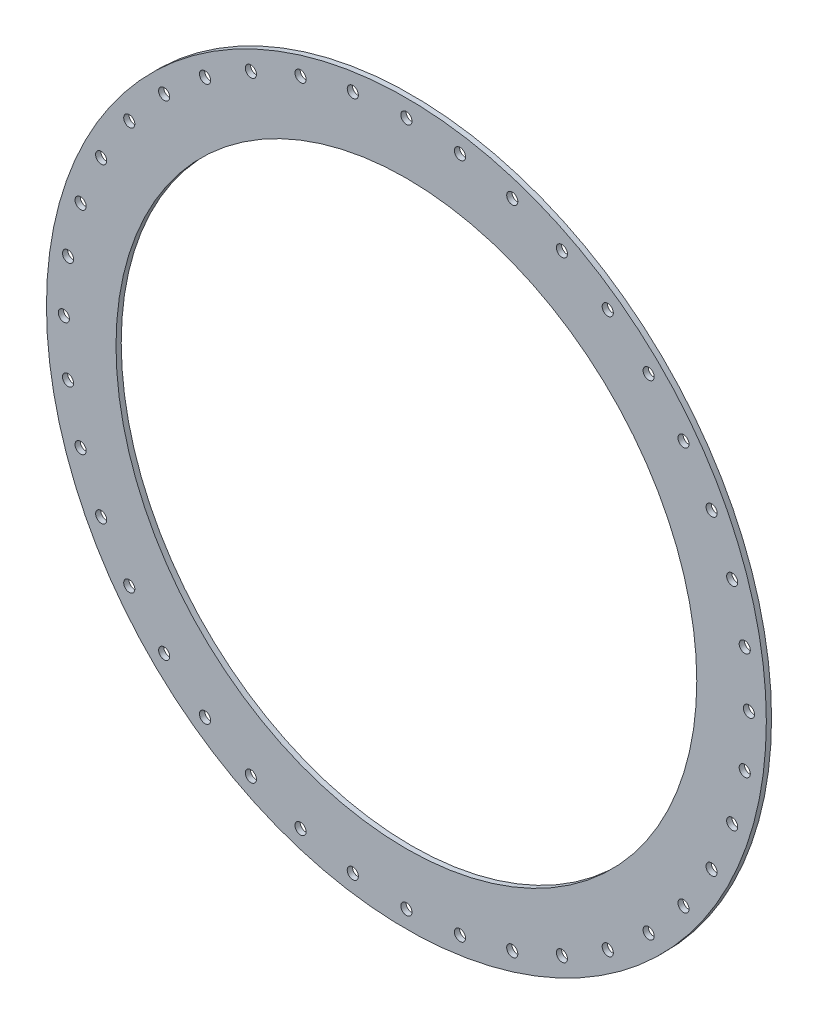
from build123d import *

# Parameters (mm, degrees)
SKETCH_1_R      = 103.5
SKETCH_1_R_2    = 83.5
SKETCH_1_R_3    = 1.6
EXTRUDE_1_DEPTH = 1.5


with BuildPart() as part:
    # 草图1 → 凸台-拉伸1 (new body)
    with BuildSketch(Plane.XY):
        Circle(SKETCH_1_R)
        Circle(SKETCH_1_R_2, mode=Mode.SUBTRACT)
        with Locations((0, 98.5)):
            Circle(SKETCH_1_R_3, mode=Mode.SUBTRACT)
        with Locations((15.408794806, 97.287301549)):
            Circle(SKETCH_1_R_3, mode=Mode.SUBTRACT)
        with Locations((30.438173946, 93.679066855)):
            Circle(SKETCH_1_R_3, mode=Mode.SUBTRACT)
        with Locations((44.718064224, 87.764142633)):
            Circle(SKETCH_1_R_3, mode=Mode.SUBTRACT)
        with Locations((57.896847351, 79.688173946)):
            Circle(SKETCH_1_R_3, mode=Mode.SUBTRACT)
        with Locations((69.650017947, 69.650017947)):
            Circle(SKETCH_1_R_3, mode=Mode.SUBTRACT)
        with Locations((79.688173946, 57.896847351)):
            Circle(SKETCH_1_R_3, mode=Mode.SUBTRACT)
        with Locations((87.764142633, 44.718064224)):
            Circle(SKETCH_1_R_3, mode=Mode.SUBTRACT)
        with Locations((93.679066855, 30.438173946)):
            Circle(SKETCH_1_R_3, mode=Mode.SUBTRACT)
        with Locations((97.287301549, 15.408794806)):
            Circle(SKETCH_1_R_3, mode=Mode.SUBTRACT)
        with Locations((98.5, 0)):
            Circle(SKETCH_1_R_3, mode=Mode.SUBTRACT)
        with Locations((97.287301549, -15.408794806)):
            Circle(SKETCH_1_R_3, mode=Mode.SUBTRACT)
        with Locations((93.679066855, -30.438173946)):
            Circle(SKETCH_1_R_3, mode=Mode.SUBTRACT)
        with Locations((87.764142633, -44.718064224)):
            Circle(SKETCH_1_R_3, mode=Mode.SUBTRACT)
        with Locations((79.688173946, -57.896847351)):
            Circle(SKETCH_1_R_3, mode=Mode.SUBTRACT)
        with Locations((69.650017947, -69.650017947)):
            Circle(SKETCH_1_R_3, mode=Mode.SUBTRACT)
        with Locations((57.896847351, -79.688173946)):
            Circle(SKETCH_1_R_3, mode=Mode.SUBTRACT)
        with Locations((44.718064224, -87.764142633)):
            Circle(SKETCH_1_R_3, mode=Mode.SUBTRACT)
        with Locations((30.438173946, -93.679066855)):
            Circle(SKETCH_1_R_3, mode=Mode.SUBTRACT)
        with Locations((15.408794806, -97.287301549)):
            Circle(SKETCH_1_R_3, mode=Mode.SUBTRACT)
        with Locations((0, -98.5)):
            Circle(SKETCH_1_R_3, mode=Mode.SUBTRACT)
        with Locations((-15.408794806, -97.287301549)):
            Circle(SKETCH_1_R_3, mode=Mode.SUBTRACT)
        with Locations((-30.438173946, -93.679066855)):
            Circle(SKETCH_1_R_3, mode=Mode.SUBTRACT)
        with Locations((-44.718064224, -87.764142633)):
            Circle(SKETCH_1_R_3, mode=Mode.SUBTRACT)
        with Locations((-57.896847351, -79.688173946)):
            Circle(SKETCH_1_R_3, mode=Mode.SUBTRACT)
        with Locations((-69.650017947, -69.650017947)):
            Circle(SKETCH_1_R_3, mode=Mode.SUBTRACT)
        with Locations((-79.688173946, -57.896847351)):
            Circle(SKETCH_1_R_3, mode=Mode.SUBTRACT)
        with Locations((-87.764142633, -44.718064224)):
            Circle(SKETCH_1_R_3, mode=Mode.SUBTRACT)
        with Locations((-93.679066855, -30.438173946)):
            Circle(SKETCH_1_R_3, mode=Mode.SUBTRACT)
        with Locations((-97.287301549, -15.408794806)):
            Circle(SKETCH_1_R_3, mode=Mode.SUBTRACT)
        with Locations((-98.5, 0)):
            Circle(SKETCH_1_R_3, mode=Mode.SUBTRACT)
        with Locations((-97.287301549, 15.408794806)):
            Circle(SKETCH_1_R_3, mode=Mode.SUBTRACT)
        with Locations((-93.679066855, 30.438173946)):
            Circle(SKETCH_1_R_3, mode=Mode.SUBTRACT)
        with Locations((-87.764142633, 44.718064224)):
            Circle(SKETCH_1_R_3, mode=Mode.SUBTRACT)
        with Locations((-79.688173946, 57.896847351)):
            Circle(SKETCH_1_R_3, mode=Mode.SUBTRACT)
        with Locations((-69.650017947, 69.650017947)):
            Circle(SKETCH_1_R_3, mode=Mode.SUBTRACT)
        with Locations((-57.896847351, 79.688173946)):
            Circle(SKETCH_1_R_3, mode=Mode.SUBTRACT)
        with Locations((-44.718064224, 87.764142633)):
            Circle(SKETCH_1_R_3, mode=Mode.SUBTRACT)
        with Locations((-30.438173946, 93.679066855)):
            Circle(SKETCH_1_R_3, mode=Mode.SUBTRACT)
        with Locations((-15.408794806, 97.287301549)):
            Circle(SKETCH_1_R_3, mode=Mode.SUBTRACT)
    extrude(amount=EXTRUDE_1_DEPTH)


solid = part.part
